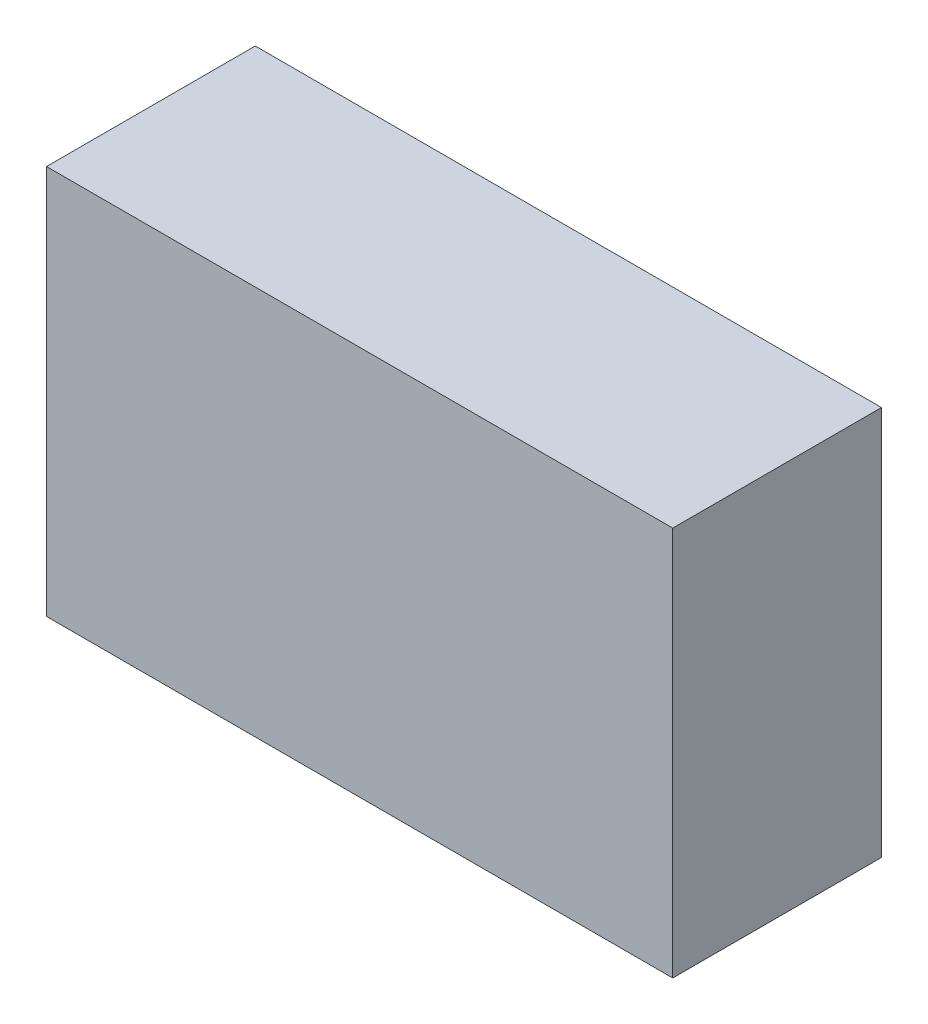
from build123d import *

# Parameters (mm, degrees)
SKETCH1_W                                  = 45
SKETCH1_H                                  = 28
REFERENCE_ENVELOPE_NOT_MANUFACTURING_DEPTH = 15


with BuildPart() as part:
    # Sketch1 → REFERENCE_ENVELOPE_NOT_MANUFACTURING (new body)
    with BuildSketch(Plane.XY):
        Rectangle(SKETCH1_W, SKETCH1_H)
    extrude(amount=REFERENCE_ENVELOPE_NOT_MANUFACTURING_DEPTH)


solid = part.part
